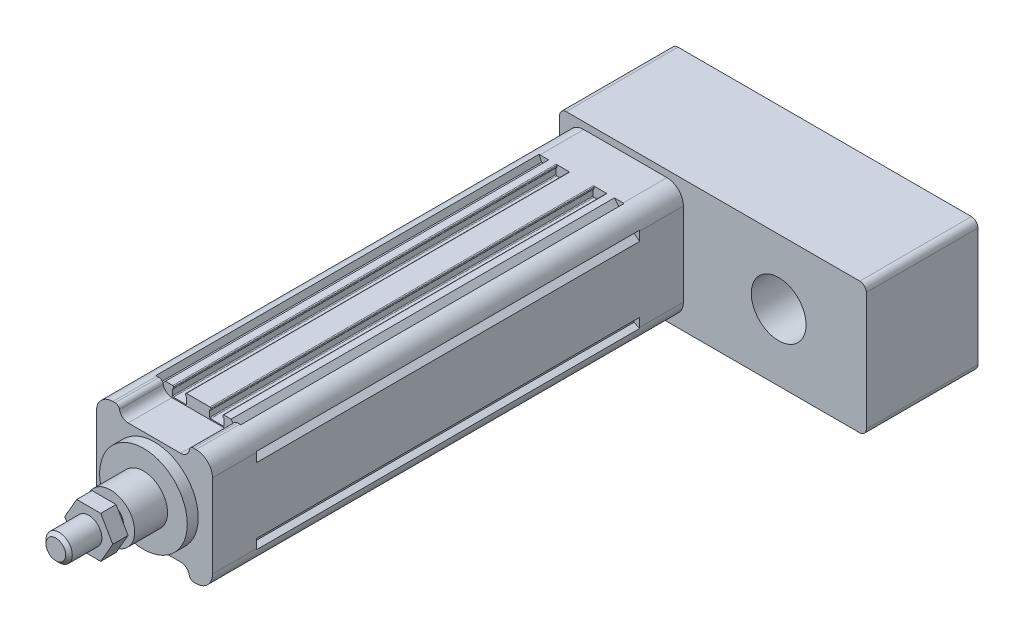
from build123d import *

# Parameters (mm, degrees)
SKETCH_1_R                  = 2.1
EXTRUDE_1_DEPTH             = 175
EXTRUDE_2_DEPTH             = 20
SKETCH_7_R                  = 20
EXTRUDE_3_DEPTH             = 5
SKETCH_9_R                  = 11
EXTRUDE_4_DEPTH             = 15
SKETCH_10_R                 = 6
EXTRUDE_5_DEPTH             = 25
EXTRUDE_START               = 20
EXTRUDE_6_DEPTH             = 20
EXTRUDE_7_DEPTH             = 51
SKETCH_13_R                 = 12.5
CUT_EXTRUDE_2_DEPTH         = 30
PATTERN_LINEAR_1_COUNT      = 2
PATTERN_LINEAR_1_PITCH      = 38
PATTERN_LINEAR_1_COUNT_DIR2 = 2
PATTERN_LINEAR_1_PITCH_DIR2 = 38
HOLE_WIZARD_M6_2_D          = 5
HOLE_WIZARD_M6_2_DEPTH      = 15
HOLE_WIZARD_M6_2_TIP        = 1.502151548
HOLE_WIZARD_M6_3_D          = 5
HOLE_WIZARD_M6_3_DEPTH      = 15
HOLE_WIZARD_M6_3_TIP        = 1.502151548
HOLE_WIZARD_M6_4_D          = 5
HOLE_WIZARD_M6_4_DEPTH      = 15
HOLE_WIZARD_M6_4_TIP        = 1.502151548
CHAMFER_1_SIZE              = 1.5
EXTRUDE_START_2             = 3
EXTRUDE_8_DEPTH             = 7


with BuildPart() as part:
    # 草图1 → 凸台-拉伸1 (new body)
    with BuildSketch(Plane.XY):
        with BuildLine():
            Line((-18.2, 24), (-19.443439638, 26.486879276))
            ThreePointArc((-19.443439638, 26.486879276), (-24.303300859, 24.303300859), (-26.486879276, 19.443439638))
            Line((-26.486879276, 19.443439638), (-24, 18.2))
            Line((-24, 18.2), (-24, 17.1))
            Line((-24, 17.1), (-26.5, 15))
            Line((-26.5, 15), (-26.5, -15))
            Line((-26.5, -15), (-24, -17.1))
            Line((-24, -17.1), (-24, -18.2))
            Line((-24, -18.2), (-26.486879276, -19.443439638))
            ThreePointArc((-26.486879276, -19.443439638), (-24.303300859, -24.303300859), (-19.443439638, -26.486879276))
            Line((-19.443439638, -26.486879276), (-18.2, -24))
            Line((-18.2, -24), (-17.1, -24))
            Line((-17.1, -24), (-15, -26.5))
            Line((-15, -26.5), (-11.65, -26.5))
            ThreePointArc((-11.65, -26.5), (-11.367157288, -26.382842712), (-11.25, -26.1))
            Line((-11.25, -26.1), (-11.25, -25.6))
            ThreePointArc((-11.25, -25.6), (-11.367157288, -25.317157288), (-11.65, -25.2))
            Line((-11.65, -25.2), (-11.75, -25.2))
            Line((-11.75, -25.2), (-11.75, -22.4))
            ThreePointArc((-11.75, -22.4), (-11.632842712, -22.117157288), (-11.35, -22))
            Line((-11.35, -22), (-5.65, -22))
            ThreePointArc((-5.65, -22), (-5.367157288, -22.117157288), (-5.25, -22.4))
            Line((-5.25, -22.4), (-5.25, -25.2))
            Line((-5.25, -25.2), (-5.35, -25.2))
            ThreePointArc((-5.35, -25.2), (-5.632842712, -25.317157288), (-5.75, -25.6))
            Line((-5.75, -25.6), (-5.75, -26.1))
            ThreePointArc((-5.75, -26.1), (-5.632842712, -26.382842712), (-5.35, -26.5))
            Line((-5.35, -26.5), (5.35, -26.5))
            ThreePointArc((5.35, -26.5), (5.632842712, -26.382842712), (5.75, -26.1))
            Line((5.75, -26.1), (5.75, -25.6))
            ThreePointArc((5.75, -25.6), (5.632842712, -25.317157288), (5.35, -25.2))
            Line((5.35, -25.2), (5.25, -25.2))
            Line((5.25, -25.2), (5.25, -22.4))
            ThreePointArc((5.25, -22.4), (5.367157288, -22.117157288), (5.65, -22))
            Line((5.65, -22), (11.35, -22))
            ThreePointArc((11.35, -22), (11.632842712, -22.117157288), (11.75, -22.4))
            Line((11.75, -22.4), (11.75, -25.2))
            Line((11.75, -25.2), (11.65, -25.2))
            ThreePointArc((11.65, -25.2), (11.367157288, -25.317157288), (11.25, -25.6))
            Line((11.25, -25.6), (11.25, -26.1))
            ThreePointArc((11.25, -26.1), (11.367157288, -26.382842712), (11.65, -26.5))
            Line((11.65, -26.5), (15, -26.5))
            Line((15, -26.5), (17.1, -24))
            Line((17.1, -24), (18.2, -24))
            Line((18.2, -24), (19.443439638, -26.486879276))
            ThreePointArc((19.443439638, -26.486879276), (24.303300859, -24.303300859), (26.486879276, -19.443439638))
            Line((26.486879276, -19.443439638), (24, -18.2))
            Line((24, -18.2), (24, -17.1))
            Line((24, -17.1), (26.5, -15))
            Line((26.5, -15), (26.5, 15))
            Line((26.5, 15), (24, 17.1))
            Line((24, 17.1), (24, 18.2))
            Line((24, 18.2), (26.486879276, 19.443439638))
            ThreePointArc((26.486879276, 19.443439638), (24.303300859, 24.303300859), (19.443439638, 26.486879276))
            Line((19.443439638, 26.486879276), (18.2, 24))
            Line((18.2, 24), (17.1, 24))
            Line((17.1, 24), (15, 26.5))
            Line((15, 26.5), (11.65, 26.5))
            ThreePointArc((11.65, 26.5), (11.367157288, 26.382842712), (11.25, 26.1))
            Line((11.25, 26.1), (11.25, 25.6))
            ThreePointArc((11.25, 25.6), (11.367157288, 25.317157288), (11.65, 25.2))
            Line((11.65, 25.2), (11.75, 25.2))
            Line((11.75, 25.2), (11.75, 22.4))
            ThreePointArc((11.75, 22.4), (11.632842712, 22.117157288), (11.35, 22))
            Line((11.35, 22), (5.65, 22))
            ThreePointArc((5.65, 22), (5.367157288, 22.117157288), (5.25, 22.4))
            Line((5.25, 22.4), (5.25, 25.2))
            Line((5.25, 25.2), (5.35, 25.2))
            ThreePointArc((5.35, 25.2), (5.632842712, 25.317157288), (5.75, 25.6))
            Line((5.75, 25.6), (5.75, 26.1))
            ThreePointArc((5.75, 26.1), (5.632842712, 26.382842712), (5.35, 26.5))
            Line((5.35, 26.5), (-5.35, 26.5))
            ThreePointArc((-5.35, 26.5), (-5.632842712, 26.382842712), (-5.75, 26.1))
            Line((-5.75, 26.1), (-5.75, 25.6))
            ThreePointArc((-5.75, 25.6), (-5.632842712, 25.317157288), (-5.35, 25.2))
            Line((-5.35, 25.2), (-5.25, 25.2))
            Line((-5.25, 25.2), (-5.25, 22.4))
            ThreePointArc((-5.25, 22.4), (-5.367157288, 22.117157288), (-5.65, 22))
            Line((-5.65, 22), (-11.35, 22))
            ThreePointArc((-11.35, 22), (-11.632842712, 22.117157288), (-11.75, 22.4))
            Line((-11.75, 22.4), (-11.75, 25.2))
            Line((-11.75, 25.2), (-11.65, 25.2))
            ThreePointArc((-11.65, 25.2), (-11.367157288, 25.317157288), (-11.25, 25.6))
            Line((-11.25, 25.6), (-11.25, 26.1))
            ThreePointArc((-11.25, 26.1), (-11.367157288, 26.382842712), (-11.65, 26.5))
            Line((-11.65, 26.5), (-15, 26.5))
            Line((-15, 26.5), (-17.1, 24))
            Line((-17.1, 24), (-18.2, 24))
        make_face()
        with Locations((19, 19)):
            Circle(SKETCH_1_R, mode=Mode.SUBTRACT)
        with Locations((19, -19)):
            Circle(SKETCH_1_R, mode=Mode.SUBTRACT)
        with Locations((-19, -19)):
            Circle(SKETCH_1_R, mode=Mode.SUBTRACT)
        with Locations((-19, 19)):
            Circle(SKETCH_1_R, mode=Mode.SUBTRACT)
        with BuildLine():
            Line((19.773719933, 3), (23.3, 3))
            Line((23.3, 3), (23.3, -3))
            Line((23.3, -3), (19.773719933, -3))
            ThreePointArc((19.773719933, -3), (0, -20), (-19.773719933, -3))
            Line((-19.773719933, -3), (-23.3, -3))
            Line((-23.3, -3), (-23.3, 3))
            Line((-23.3, 3), (-19.773719933, 3))
            ThreePointArc((-19.773719933, 3), (0, 20), (19.773719933, 3))
        make_face(mode=Mode.SUBTRACT)
    extrude(amount=EXTRUDE_1_DEPTH)

    # 草图6 → 凸台-拉伸2 (add)
    with BuildSketch(Plane.XY.offset(175)):
        with BuildLine():
            Line((-26.5, -19), (-26.5, 19))
            ThreePointArc((-26.5, 19), (-24.303300859, 24.303300859), (-19, 26.5))
            Line((-19, 26.5), (-17.916079783, 26.5))
            ThreePointArc((-17.916079783, 26.5), (-16.625085334, 26.027525232), (-15.944053189, 24.833333333))
            ThreePointArc((-15.944053189, 24.833333333), (-14.581988897, 22.444949537), (-12, 21.5))
            Line((-12, 21.5), (12, 21.5))
            ThreePointArc((12, 21.5), (14.581988897, 22.444949537), (15.944053189, 24.833333333))
            ThreePointArc((15.944053189, 24.833333333), (16.625085334, 26.027525232), (17.916079783, 26.5))
            Line((17.916079783, 26.5), (19, 26.5))
            ThreePointArc((19, 26.5), (24.303300859, 24.303300859), (26.5, 19))
            Line((26.5, 19), (26.5, -19))
            ThreePointArc((26.5, -19), (24.303300859, -24.303300859), (19, -26.5))
            Line((19, -26.5), (17.916079783, -26.5))
            ThreePointArc((17.916079783, -26.5), (16.625085334, -26.027525232), (15.944053189, -24.833333333))
            ThreePointArc((15.944053189, -24.833333333), (14.581988897, -22.444949537), (12, -21.5))
            Line((12, -21.5), (-12, -21.5))
            ThreePointArc((-12, -21.5), (-14.581988897, -22.444949537), (-15.944053189, -24.833333333))
            ThreePointArc((-15.944053189, -24.833333333), (-16.625085334, -26.027525232), (-17.916079783, -26.5))
            Line((-17.916079783, -26.5), (-19, -26.5))
            ThreePointArc((-19, -26.5), (-24.303300859, -24.303300859), (-26.5, -19))
        make_face()
    extrude(amount=EXTRUDE_2_DEPTH)

    # 草图7 → 凸台-拉伸3 (add)
    with BuildSketch(Plane.XY.offset(195)):
        Circle(SKETCH_7_R)
    extrude(amount=EXTRUDE_3_DEPTH)

    # 草图9 → 凸台-拉伸4 (add)
    with BuildSketch(Plane.XY.offset(200)):
        Circle(SKETCH_9_R)
    extrude(amount=EXTRUDE_4_DEPTH)

    # 草图10 → 凸台-拉伸5 (add)
    with BuildSketch(Plane.XY.offset(215)):
        Circle(SKETCH_10_R)
    extrude(amount=EXTRUDE_5_DEPTH)

    # 草图11 → 凸台-拉伸6 (add)
    with BuildSketch(Plane(origin=(0, 0, 0), x_dir=(-1, 0, 0), z_dir=(0, 0, -1)).offset(EXTRUDE_START)):
        with BuildLine():
            Line((-19, -26.5), (19, -26.5))
            ThreePointArc((19, -26.5), (24.303300859, -24.303300859), (26.5, -19))
            Line((26.5, -19), (26.5, 19))
            ThreePointArc((26.5, 19), (24.303300859, 24.303300859), (19, 26.5))
            Line((19, 26.5), (-19, 26.5))
            ThreePointArc((-19, 26.5), (-24.303300859, 24.303300859), (-26.5, 19))
            Line((-26.5, 19), (-26.5, -19))
            ThreePointArc((-26.5, -19), (-24.303300859, -24.303300859), (-19, -26.5))
        make_face()
    extrude(amount=-EXTRUDE_6_DEPTH)

    # 草图12 → 凸台-拉伸7 (add)
    with BuildSketch(Plane(origin=(0, 0, -20), x_dir=(-1, 0, 0), z_dir=(0, 0, -1))):
        with BuildLine():
            Line((-107, -30.404162038), (27, -30.404162038))
            ThreePointArc((27, -30.404162038), (29.121320344, -29.525482382), (30, -27.404162038))
            Line((30, -27.404162038), (30, 26.595837962))
            ThreePointArc((30, 26.595837962), (29.121320344, 28.717158305), (27, 29.595837962))
            Line((27, 29.595837962), (-107, 29.595837962))
            ThreePointArc((-107, 29.595837962), (-109.121320344, 28.717158305), (-110, 26.595837962))
            Line((-110, 26.595837962), (-110, -27.404162038))
            ThreePointArc((-110, -27.404162038), (-109.121320344, -29.525482382), (-107, -30.404162038))
        make_face()
    extrude(amount=EXTRUDE_7_DEPTH)

    # 草图13 → 切除-拉伸2 (cut)
    with BuildSketch(Plane.XY.offset(-20)):
        with Locations((70, 0)):
            Circle(SKETCH_13_R)
    extrude(amount=-CUT_EXTRUDE_2_DEPTH, mode=Mode.SUBTRACT)

    # 草图15 → M6 螺纹孔1 (revolve, cut)
    with BuildSketch(Plane(origin=(-19, -19, -71), x_dir=(0, 1, 0), z_dir=(1, 0, 0))):
        Polygon((0, 0), (0, 16.502151548), (2.5, 15), (2.5, 0), align=None)
    hole_wizard_m6_1 = revolve(axis=Axis((-19, -19, -77.35), (0, 0, 1)), mode=Mode.SUBTRACT)

    # 阵列(线性)1: Hole Wizard M6 _1 2 × 2
    with Locations(*[(j * PATTERN_LINEAR_1_PITCH_DIR2, i * PATTERN_LINEAR_1_PITCH, 0) for i in range(PATTERN_LINEAR_1_COUNT) for j in range(PATTERN_LINEAR_1_COUNT_DIR2) if (i, j) != (0, 0)]):
        add(hole_wizard_m6_1, mode=Mode.SUBTRACT)

    # M6 螺纹孔2
    with Locations(Plane(origin=(0, 0, -71), x_dir=(-1, 0, 0), z_dir=(0, 0, -1))):
        with Locations((-84, -19), (-84, 19)):
            Hole(HOLE_WIZARD_M6_2_D / 2, depth=HOLE_WIZARD_M6_2_DEPTH)
            with Locations((0, 0, -(HOLE_WIZARD_M6_2_DEPTH + HOLE_WIZARD_M6_2_TIP / 2))):  # 118° drill point
                Cone(0, HOLE_WIZARD_M6_2_D / 2, HOLE_WIZARD_M6_2_TIP, mode=Mode.SUBTRACT)

    # M6 螺纹孔3
    with Locations(Plane.ZY.offset(26.5)):
        with Locations((185, 11), (185, -11)):
            Hole(HOLE_WIZARD_M6_3_D / 2, depth=HOLE_WIZARD_M6_3_DEPTH)
            with Locations((0, 0, -(HOLE_WIZARD_M6_3_DEPTH + HOLE_WIZARD_M6_3_TIP / 2))):  # 118° drill point
                Cone(0, HOLE_WIZARD_M6_3_D / 2, HOLE_WIZARD_M6_3_TIP, mode=Mode.SUBTRACT)

    # M6 螺纹孔4
    with Locations(Plane.ZY.offset(26.5)):
        with Locations((-10, 11), (-10, -11)):
            Hole(HOLE_WIZARD_M6_4_D / 2, depth=HOLE_WIZARD_M6_4_DEPTH)
            with Locations((0, 0, -(HOLE_WIZARD_M6_4_DEPTH + HOLE_WIZARD_M6_4_TIP / 2))):  # 118° drill point
                Cone(0, HOLE_WIZARD_M6_4_D / 2, HOLE_WIZARD_M6_4_TIP, mode=Mode.SUBTRACT)

    # 倒角1
    chamfer_1_edges = [part.edges().sort_by_distance(p)[0] for p in [
        (-6, 0, 240),
    ]]
    chamfer(chamfer_1_edges, length=CHAMFER_1_SIZE)

    # 草图23 → 凸台-拉伸8 (add)
    with BuildSketch(Plane.XY.offset(215).offset(EXTRUDE_START_2)):
        Polygon((10.969655115, 0), (5.484827557, 9.5), (-5.484827557, 9.5), (-10.969655115, 0), (-5.484827557, -9.5), (5.484827557, -9.5), align=None)
    extrude(amount=EXTRUDE_8_DEPTH)


solid = part.part
